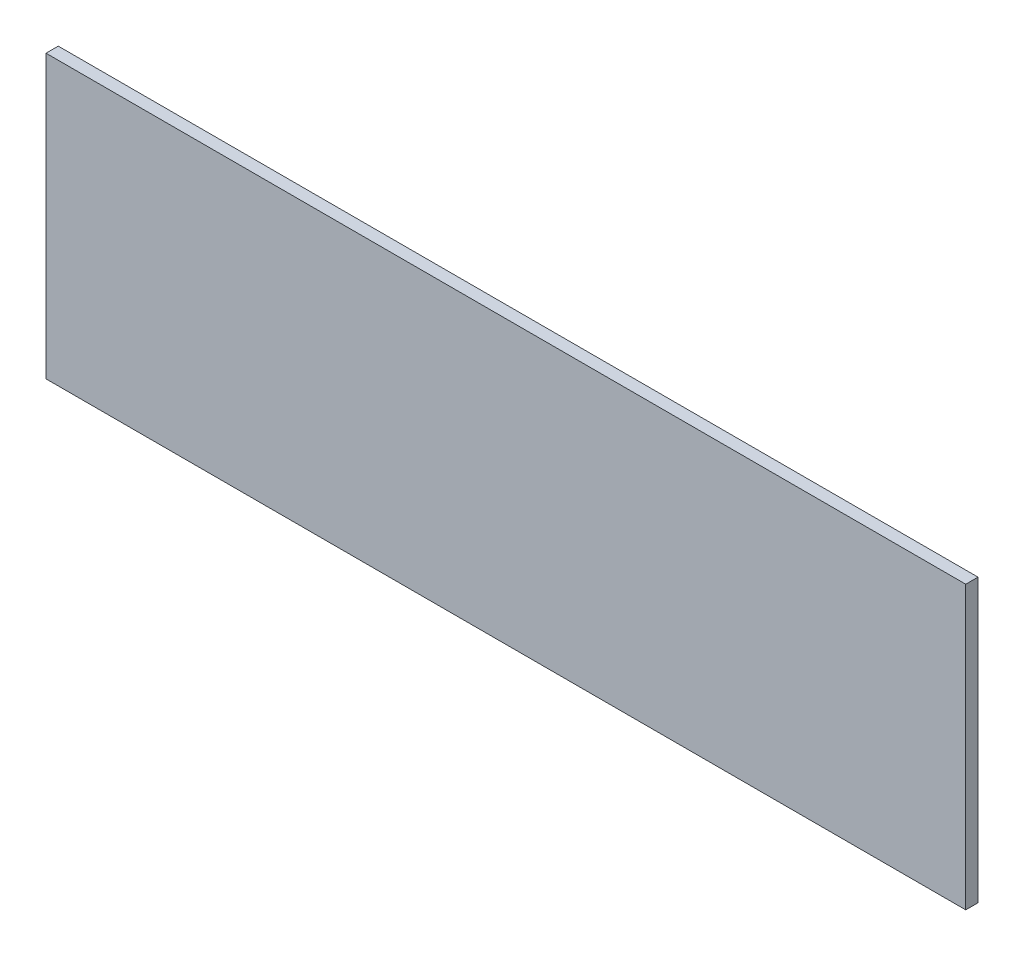
from build123d import *

# Parameters (mm, degrees)
SKETCH1_W           = 900
SKETCH1_H           = 276
BOSS_EXTRUDE1_DEPTH = 12


with BuildPart() as part:
    # Sketch1 → Boss-Extrude1 (new body)
    with BuildSketch(Plane.XY):
        with Locations((450, 138)):
            Rectangle(SKETCH1_W, SKETCH1_H)
    extrude(amount=BOSS_EXTRUDE1_DEPTH)


solid = part.part
